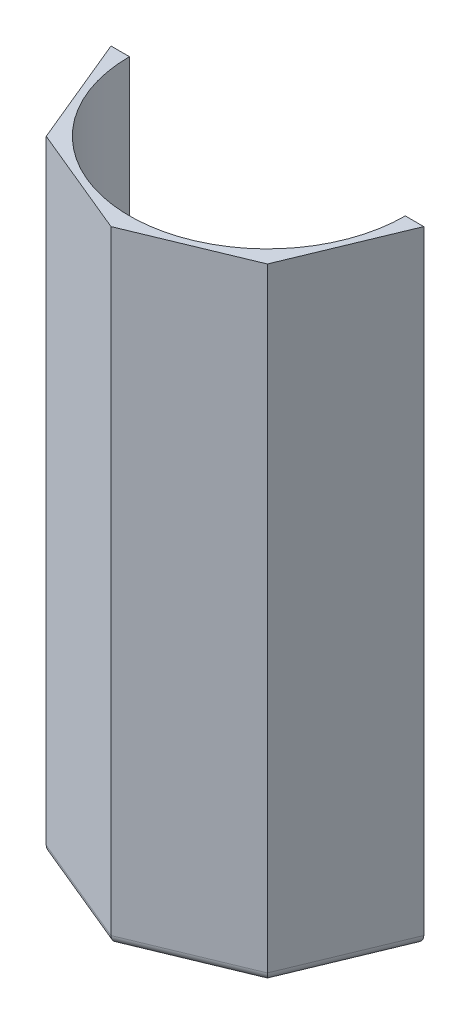
from build123d import *

# Parameters (mm, degrees)
BOSS_EXTRUDE1_DEPTH = 140
SKETCH2_R           = 31
CUT_EXTRUDE1_DEPTH  = 133.5
SKETCH3_R           = 26
CUT_EXTRUDE2_DEPTH  = 133.5
FILLET1_R           = 2
CUT_EXTRUDE3_DEPTH  = 173.5


with BuildPart() as part:
    # Sketch1 → Boss-Extrude1 (new body)
    with BuildSketch(Plane(origin=(0, 0, 0), x_dir=(1, 0, 0), z_dir=(0, 1, 0))):
        Polygon((35.15, 0), (24.854803359, 24.854803359), (0, 35.15), (-24.854803359, 24.854803359), (-35.15, 0), (-24.854803359, -24.854803359), (0, -35.15), (24.854803359, -24.854803359), align=None)
    extrude(amount=BOSS_EXTRUDE1_DEPTH)

    # Sketch2 → Cut-Extrude1 (cut)
    with BuildSketch(Plane(origin=(0, 140, 0), x_dir=(1, 0, 0), z_dir=(0, 1, 0))):
        with Locations(Location((0, 0, 0), (0, 0, 270))):
            Circle(SKETCH2_R)
    extrude(amount=-CUT_EXTRUDE1_DEPTH, mode=Mode.SUBTRACT)

    # Sketch3 → Cut-Extrude2 (cut)
    with BuildSketch(Plane(origin=(0, 0, 0), x_dir=(-1, 0, 0), z_dir=(0, -1, 0))):
        with Locations(Location((0, 0, 0), (0, 0, 90))):
            Circle(SKETCH3_R)
    extrude(amount=-CUT_EXTRUDE2_DEPTH, mode=Mode.SUBTRACT)

    # Fillet1
    fillet1_edges = [part.edges().sort_by_distance(p)[0] for p in [
        (30.002401679, 0, -12.427401679),
        (30.002401679, 0, 12.427401679),
        (12.427401679, 0, 30.002401679),
        (-12.427401679, 0, 30.002401679),
        (-30.002401679, 0, 12.427401679),
        (-30.002401679, 0, -12.427401679),
        (-12.427401679, 0, -30.002401679),
        (12.427401679, 0, -30.002401679),
    ]]
    fillet(fillet1_edges, radius=FILLET1_R)

    # Sketch4 → Cut-Extrude3 (cut)
    with BuildSketch(Plane(origin=(0, 140, 0), x_dir=(1, 0, 0), z_dir=(0, 1, 0))):
        Polygon((-35.15, 0), (35.15, 0), (24.854803359, 24.854803359), (0, 35.15), (-24.854803359, 24.854803359), align=None)
    extrude(amount=-CUT_EXTRUDE3_DEPTH, mode=Mode.SUBTRACT)


solid = part.part
